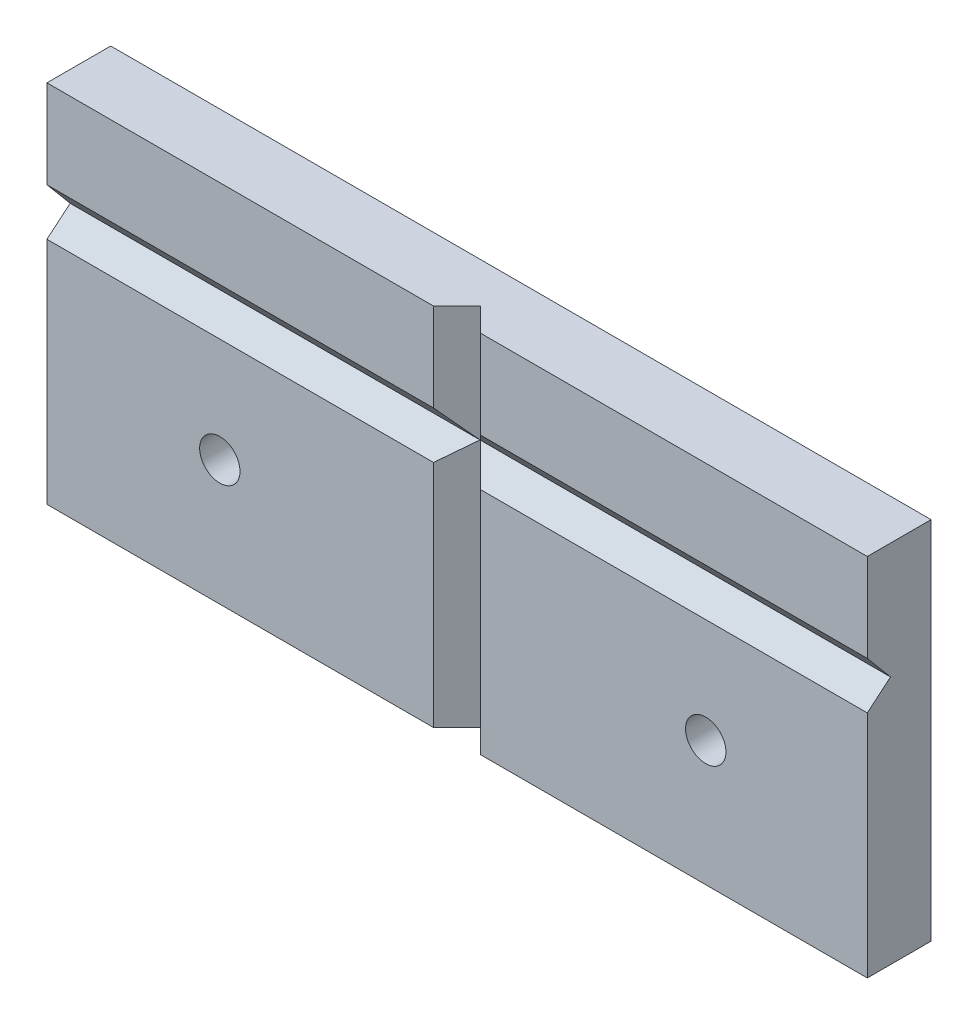
from build123d import *

# Parameters (mm, degrees)
BOSS_EXTRUDE1_DEPTH     = 7.8994
CUT_EXTRUDE1_DEPTH      = 132.627694139
CUT_EXTRUDE1_DEPTH_BACK = 132.627694139
CUT_EXTRUDE2_DEPTH      = 112.485808354
CUT_EXTRUDE2_DEPTH_BACK = 112.485808354
M6X1_0_TAPPED_HOLE1_D   = 5


with BuildPart() as part:
    # Sketch1 → Boss-Extrude1 (new body)
    with BuildSketch(Plane.XY):
        Polygon((-101.6, 83.312), (-101.6, 38.1), (-69.85, 38.1), (-31.75, 38.1), (0, 38.1), (0, 83.312), align=None)
    extrude(amount=BOSS_EXTRUDE1_DEPTH)

    # Sketch2 → Cut-Extrude1 (cut, two sides: drawn at the far end of the back side and taken through both)
    with BuildSketch(Plane.ZY.offset(101.6).offset(-CUT_EXTRUDE1_DEPTH_BACK)):
        Polygon((59.566381815, 133.911082828), (7.8994, 72.376195004), (5.022457184, 68.949783256), (7.8994, 66.534195004), (69.434287825, 14.867213189), (229.583733305, 28.142484569), (219.715827295, 147.186354208), align=None)
    extrude(amount=CUT_EXTRUDE1_DEPTH + CUT_EXTRUDE1_DEPTH_BACK, mode=Mode.SUBTRACT)

    # Sketch3 → Cut-Extrude2 (cut, two sides: drawn at the far end of the back side and taken through both)
    with BuildSketch(Plane(origin=(0, 83.312, 0), x_dir=(1, 0, 0), z_dir=(0, 1, 0)).offset(-CUT_EXTRUDE2_DEPTH_BACK)):
        Polygon((35.981993731, -91.760393731), (-47.879, -7.8994), (-50.8, -4.9784), (-53.721, -7.8994), (-137.581993731, -91.760393731), (-137.581993731, -328.955103109), (35.981993731, -328.955103109), align=None)
    extrude(amount=CUT_EXTRUDE2_DEPTH + CUT_EXTRUDE2_DEPTH_BACK, mode=Mode.SUBTRACT)

    # M6x1.0 Tapped Hole1 (through all)
    with Locations(Plane(origin=(-50.8, 0, 0), x_dir=(-1, 0, 0), z_dir=(0, 0, -1))):
        with Locations((-30.795161674, 53.586240129), (29.387245779, 53.586240129)):
            Hole(M6X1_0_TAPPED_HOLE1_D / 2)


solid = part.part
